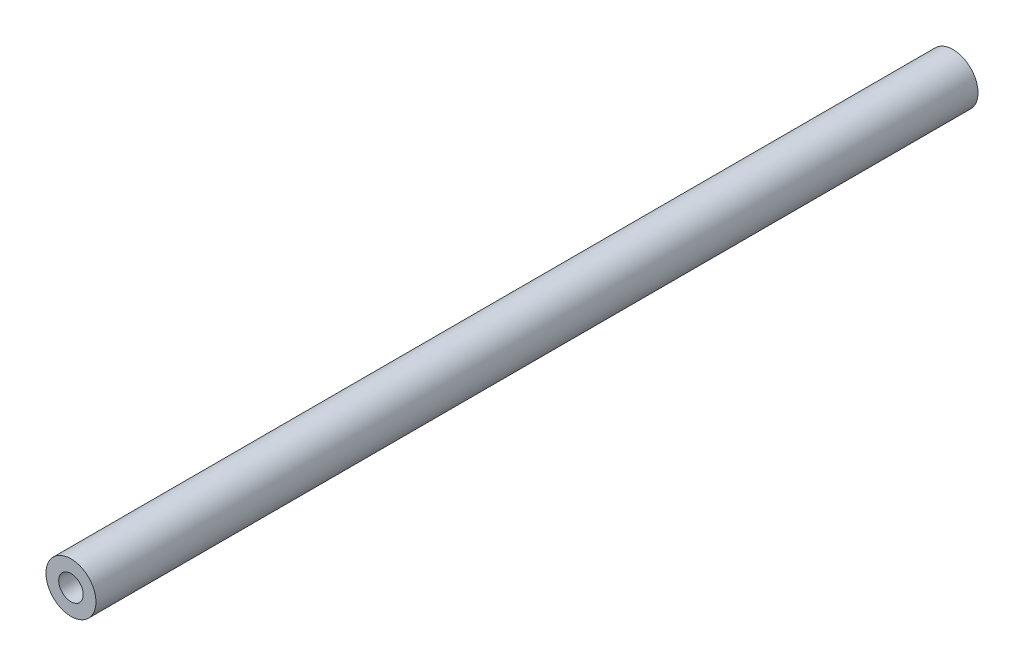
from build123d import *

# Parameters (mm, degrees)
SKETCH1_R           = 6.477
SKETCH1_R_2         = 3.175
BOSS_EXTRUDE1_DEPTH = 228.6
SKETCH2_W           = 7.62
SKETCH2_H           = 7.9375
CUT_EXTRUDE1_DEPTH  = 229.783441398


with BuildPart() as part:
    # Sketch1 → Boss-Extrude1 (new body)
    with BuildSketch(Plane.XY):
        Circle(SKETCH1_R)
        Circle(SKETCH1_R_2, mode=Mode.SUBTRACT)
    extrude(amount=BOSS_EXTRUDE1_DEPTH)

    # Sketch2 → Cut-Extrude1 (cut, through all)
    with BuildSketch(Plane(origin=(0, 0, 0), x_dir=(1, 0, 0), z_dir=(0, 1, 0))):
        with Locations((-2.667, -188.11875)):
            Rectangle(SKETCH2_W, SKETCH2_H)
    extrude(amount=-CUT_EXTRUDE1_DEPTH, mode=Mode.SUBTRACT)


solid = part.part
